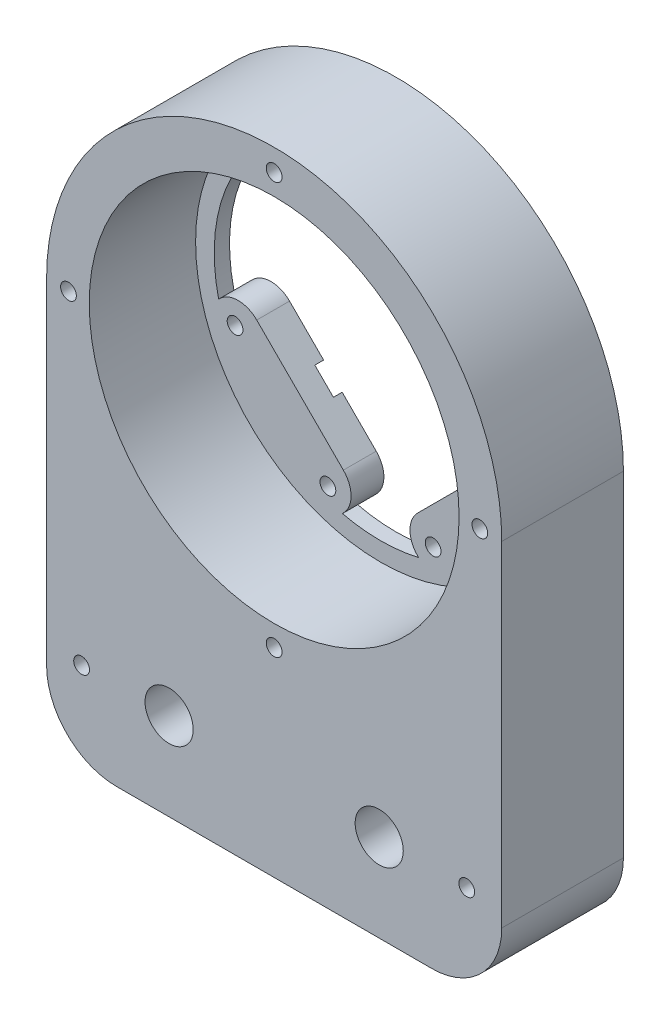
from build123d import *

# Parameters (mm, degrees)
SKETCH_2_R                  = 19
SKETCH_2_R_2                = 2.75
EXTRUDE_1_DEPTH             = 13.9
SKETCH_3_R                  = 21.125
CUT_EXTRUDE_1_DEPTH         = 12.15
SKETCH_4_R                  = 5
CUT_EXTRUDE_2_DEPTH         = 3
FILLET_1_R                  = 8
SKETCH_5_R                  = 0.9
CUT_EXTRUDE_3_DEPTH         = 60.993937194
SKETCH_6_R                  = 0.9
EXTRUDE_2_DEPTH             = 2
EXTRUDE_2_DIRECTION_2_REACH = 61.994
CUT_EXTRUDE_4_DEPTH         = 1


with BuildPart() as part:
    # Эскиз2 → Бобышка-Вытянуть1 (new body)
    with BuildSketch(Plane.XY):
        with BuildLine():
            ThreePointArc((26, 26.25), (0, 52.25), (-26, 26.25))
            Line((-26, 26.25), (-26, -20))
            Line((-26, -20), (26, -20))
            Line((26, -20), (26, 26.25))
        make_face()
        with Locations((0, 26.25)):
            Circle(SKETCH_2_R, mode=Mode.SUBTRACT)
        with Locations((12, -10)):
            Circle(SKETCH_2_R_2, mode=Mode.SUBTRACT)
        with Locations((-12, -10)):
            Circle(SKETCH_2_R_2, mode=Mode.SUBTRACT)
    extrude(amount=EXTRUDE_1_DEPTH)

    # Эскиз3 → Вырез-Вытянуть1 (cut)
    with BuildSketch(Plane.XY.offset(13.9)):
        with Locations((0, 26.25)):
            Circle(SKETCH_3_R)
    extrude(amount=-CUT_EXTRUDE_1_DEPTH, mode=Mode.SUBTRACT)

    # Эскиз4 → Вырез-Вытянуть2 (cut)
    with BuildSketch(Plane(origin=(0, 0, 0), x_dir=(-1, 0, 0), z_dir=(0, 0, -1))):
        with Locations((-12, -10)):
            Circle(SKETCH_4_R)
        with Locations((12, -10)):
            Circle(SKETCH_4_R)
    extrude(amount=-CUT_EXTRUDE_2_DEPTH, mode=Mode.SUBTRACT)

    # Скругление1
    fillet_1_edges = [part.edges().sort_by_distance(p)[0] for p in [
        (26, -20, 6.95),
        (-26, -20, 6.95),
    ]]
    fillet(fillet_1_edges, radius=FILLET_1_R)

    # Эскиз5 → Вырез-Вытянуть3 (cut, through all)
    with BuildSketch(Plane.XY.offset(13.9)):
        with Locations((0, 49.75)):
            Circle(SKETCH_5_R)
        with Locations((-23.5, 26.25)):
            Circle(SKETCH_5_R)
        with Locations((0, 2.75)):
            Circle(SKETCH_5_R)
        with Locations((23.5, 26.25)):
            Circle(SKETCH_5_R)
        with Locations((-22, -10)):
            Circle(SKETCH_5_R)
        with Locations(Location((22, -10, 0), (0, 0, 180))):
            Circle(SKETCH_5_R)
    extrude(amount=-CUT_EXTRUDE_3_DEPTH, mode=Mode.SUBTRACT)

    # Эскиз6 → Бобышка-Вытянуть2 (add)
    # profile 1 of 2: a face of its own
    with BuildSketch(Plane(origin=(0, 0, 0), x_dir=(-1, 0, 0), z_dir=(0, 0, -1))):
        with BuildLine():
            Line((-22.627416998, 17.764718626), (-18.384776311, 22.007359313))
            ThreePointArc((-18.384776311, 22.007359313), (-16.263455967, 22.886038969), (-14.142135624, 22.007359313))
            Line((-14.142135624, 22.007359313), (-4.242640687, 12.107864376))
            ThreePointArc((-4.242640687, 12.107864376), (-3.363961031, 9.986544033), (-4.242640687, 7.865223689))
            Line((-4.242640687, 7.865223689), (-8.485281374, 3.622583002))
            ThreePointArc((-8.485281374, 3.622583002), (-10.606601718, 2.743903346), (-12.727922061, 3.622583002))
            Line((-12.727922061, 3.622583002), (-22.627416998, 13.522077939))
            ThreePointArc((-22.627416998, 13.522077939), (-23.506096654, 15.643398282), (-22.627416998, 17.764718626))
        make_face()
        with Locations((-16.617009358, 20.23959236)):
            Circle(SKETCH_6_R, mode=Mode.SUBTRACT)
        with Locations((-6.01040764, 9.632990642)):
            Circle(SKETCH_6_R, mode=Mode.SUBTRACT)
    # profile 2 of 2: a face of its own
    with BuildSketch(Plane(origin=(0, 0, 0), x_dir=(-1, 0, 0), z_dir=(0, 0, -1))):
        with BuildLine():
            Line((14.142135624, 22.007359313), (4.242640687, 12.107864376))
            ThreePointArc((4.242640687, 12.107864376), (3.363961031, 9.986544033), (4.242640687, 7.865223689))
            Line((4.242640687, 7.865223689), (8.485281374, 3.622583002))
            ThreePointArc((8.485281374, 3.622583002), (10.606601718, 2.743903346), (12.727922061, 3.622583002))
            Line((12.727922061, 3.622583002), (22.627416998, 13.522077939))
            ThreePointArc((22.627416998, 13.522077939), (23.506096654, 15.643398282), (22.627416998, 17.764718626))
            Line((22.627416998, 17.764718626), (18.384776311, 22.007359313))
            ThreePointArc((18.384776311, 22.007359313), (16.263455967, 22.886038969), (14.142135624, 22.007359313))
        make_face()
        with Locations(Location((6.01040764, 9.632990642, 0), (0, 0, 180))):
            Circle(SKETCH_6_R, mode=Mode.SUBTRACT)
        with Locations(Location((16.617009358, 20.23959236, 0), (0, 0, 180))):
            Circle(SKETCH_6_R, mode=Mode.SUBTRACT)
    extrude(amount=EXTRUDE_2_DEPTH)

    # Бобышка-Вытянуть2 direction 2: up to this face of the body (flat: up to its plane)
    extrude_2_direction_2_end = Plane(part.part.faces().sort_by_distance((-20.52749477, 26.25, 1.75))[0])
    # Эскиз6 → Бобышка-Вытянуть2 direction 2 (add, up to the picked face)
    with BuildSketch(Plane(origin=(0, 0, 0), x_dir=(-1, 0, 0), z_dir=(0, 0, -1)), mode=Mode.PRIVATE) as extrude_2_direction_2_sk1:
        with BuildLine():
            Line((-22.627416998, 17.764718626), (-18.384776311, 22.007359313))
            ThreePointArc((-18.384776311, 22.007359313), (-16.263455967, 22.886038969), (-14.142135624, 22.007359313))
            Line((-14.142135624, 22.007359313), (-4.242640687, 12.107864376))
            ThreePointArc((-4.242640687, 12.107864376), (-3.363961031, 9.986544033), (-4.242640687, 7.865223689))
            Line((-4.242640687, 7.865223689), (-8.485281374, 3.622583002))
            ThreePointArc((-8.485281374, 3.622583002), (-10.606601718, 2.743903346), (-12.727922061, 3.622583002))
            Line((-12.727922061, 3.622583002), (-22.627416998, 13.522077939))
            ThreePointArc((-22.627416998, 13.522077939), (-23.506096654, 15.643398282), (-22.627416998, 17.764718626))
        make_face()
        with Locations((-16.617009358, 20.23959236)):
            Circle(SKETCH_6_R, mode=Mode.SUBTRACT)
        with Locations((-6.01040764, 9.632990642)):
            Circle(SKETCH_6_R, mode=Mode.SUBTRACT)
    extrude_2_direction_2_tool1 = split(extrude(extrude_2_direction_2_sk1.sketch, amount=-EXTRUDE_2_DIRECTION_2_REACH, mode=Mode.PRIVATE), bisect_by=extrude_2_direction_2_end, keep=Keep.BOTH, mode=Mode.PRIVATE)
    # Эскиз6 → Бобышка-Вытянуть2 direction 2 (add, up to the picked face)
    with BuildSketch(Plane(origin=(0, 0, 0), x_dir=(-1, 0, 0), z_dir=(0, 0, -1)), mode=Mode.PRIVATE) as extrude_2_direction_2_sk2:
        with BuildLine():
            Line((14.142135624, 22.007359313), (4.242640687, 12.107864376))
            ThreePointArc((4.242640687, 12.107864376), (3.363961031, 9.986544033), (4.242640687, 7.865223689))
            Line((4.242640687, 7.865223689), (8.485281374, 3.622583002))
            ThreePointArc((8.485281374, 3.622583002), (10.606601718, 2.743903346), (12.727922061, 3.622583002))
            Line((12.727922061, 3.622583002), (22.627416998, 13.522077939))
            ThreePointArc((22.627416998, 13.522077939), (23.506096654, 15.643398282), (22.627416998, 17.764718626))
            Line((22.627416998, 17.764718626), (18.384776311, 22.007359313))
            ThreePointArc((18.384776311, 22.007359313), (16.263455967, 22.886038969), (14.142135624, 22.007359313))
        make_face()
        with Locations(Location((6.01040764, 9.632990642, 0), (0, 0, 180))):
            Circle(SKETCH_6_R, mode=Mode.SUBTRACT)
        with Locations(Location((16.617009358, 20.23959236, 0), (0, 0, 180))):
            Circle(SKETCH_6_R, mode=Mode.SUBTRACT)
    extrude_2_direction_2_tool2 = split(extrude(extrude_2_direction_2_sk2.sketch, amount=-EXTRUDE_2_DIRECTION_2_REACH, mode=Mode.PRIVATE), bisect_by=extrude_2_direction_2_end, keep=Keep.BOTH, mode=Mode.PRIVATE)
    add(extrude_2_direction_2_tool1.solids().sort_by(Axis((13.48255, 12.76745, 0), (0, 0, 1)))[0])
    add(extrude_2_direction_2_tool2.solids().sort_by(Axis((-13.48255, 12.76745, 0), (0, 0, 1)))[0])

    # Эскиз7 → Вырез-Вытянуть4 (cut)
    with BuildSketch(Plane(origin=(0, 0, -2), x_dir=(-1, 0, 0), z_dir=(0, 0, -1))):
        with BuildLine():
            Line((-15.202795796, 13.168524548), (-10.253048327, 18.118272016))
            ThreePointArc((-10.253048327, 18.118272016), (-8.131727984, 18.118272016), (-8.131727984, 15.996951673))
            Line((-8.131727984, 15.996951673), (-13.081475452, 11.047204204))
            ThreePointArc((-13.081475452, 11.047204204), (-15.202795796, 11.047204204), (-15.202795796, 13.168524548))
        make_face()
        with BuildLine():
            Line((15.202795796, 13.168524548), (10.253048327, 18.118272016))
            ThreePointArc((10.253048327, 18.118272016), (8.131727984, 18.118272016), (8.131727984, 15.996951673))
            Line((8.131727984, 15.996951673), (13.081475452, 11.047204204))
            ThreePointArc((13.081475452, 11.047204204), (15.202795796, 11.047204204), (15.202795796, 13.168524548))
        make_face()
    extrude(amount=-CUT_EXTRUDE_4_DEPTH, mode=Mode.SUBTRACT)


solid = part.part
